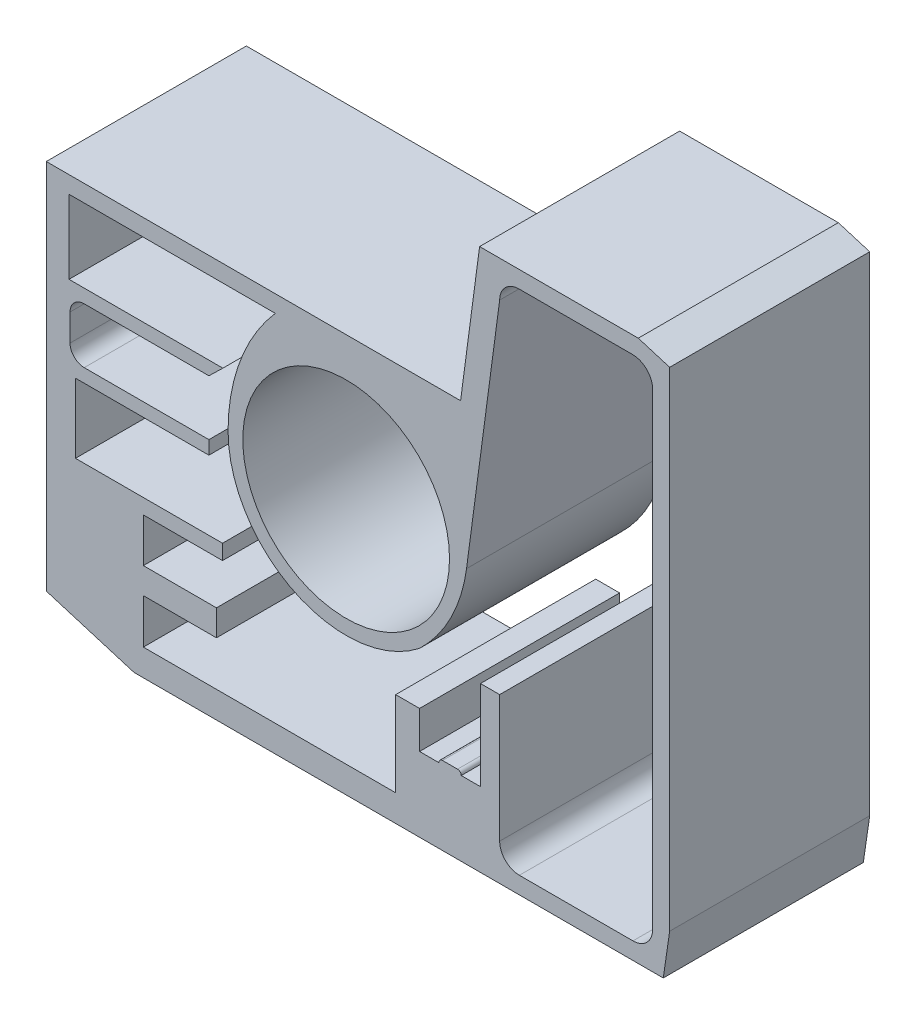
from build123d import *

# Parameters (mm, degrees)
CROQUIS1_R              = 36.48
SALIENTE_EXTRUIR1_DEPTH = 35.3


with BuildPart() as part:
    # Croquis1 → Saliente-Extruir1 (new, symmetric)
    with BuildSketch(Plane.XY):
        Polygon((114.170497813, 97.385634303), (103.092241408, 100.742040907), (47.092241408, 100.742040907), (40.383016369, 50.277319492), (-25, 50.277319492), (-105.829502187, 50.277319492), (-105.829502187, -81.012611613), (-74.846281109, -90.399674345), (111.911647615, -90.399674345), (114.170497813, -74.959018563), align=None)
        Circle(CROQUIS1_R, mode=Mode.SUBTRACT)
        with BuildLine():
            Line((39.311090941, -62.873407285), (33.988381842, -62.873407285))
            ThreePointArc((33.988381842, -62.873407285), (33.069143027, -63.25416847), (32.688381842, -64.173407285))
            Line((32.688381842, -64.173407285), (25.899736392, -64.173407285))
            Line((25.899736392, -64.173407285), (25.899736392, -51.012611613))
            Line((25.899736392, -51.012611613), (17.468766423, -51.012611613))
            Line((17.468766423, -51.012611613), (17.468766423, -64.173407285))
            Line((17.468766423, -64.173407285), (17.468766423, -81.012611613))
            Line((17.468766423, -81.012611613), (-71.573973225, -81.012611613))
            Line((-71.573973225, -81.012611613), (-71.573973225, -65.27493481))
            Line((-71.573973225, -65.27493481), (-45.773973225, -65.27493481))
            Line((-45.773973225, -65.27493481), (-45.773973225, -56.101811779))
            Line((-45.773973225, -56.101811779), (-71.573973225, -56.101811779))
            Line((-71.573973225, -56.101811779), (-71.573973225, -40.601811779))
            Line((-71.573973225, -40.601811779), (-43.629552583, -40.601811779))
            Line((-43.629552583, -40.601811779), (-43.629552583, -35.286923245))
            Line((-43.629552583, -35.286923245), (-95.529552548, -35.288826129))
            Line((-95.529552548, -35.288826129), (-95.530450826, -10.788826145))
            Line((-95.530450826, -10.788826145), (-48.440569068, -10.788826145))
            Line((-48.440569068, -10.788826145), (-48.440569068, -6.028234661))
            Line((-48.440569068, -6.028234661), (-92.440569068, -6.028234661))
            ThreePointArc((-92.440569068, -6.028234661), (-95.977129578, -4.562741665), (-97.440568225, -1.025330565))
            Line((-97.440568225, -1.025330565), (-97.440568225, 8.474669435))
            ThreePointArc((-97.440568225, 8.474669435), (-95.977129578, 12.012080534), (-92.440569068, 13.47757353))
            Line((-92.440569068, 13.47757353), (-48.440569068, 13.47757353))
            Line((-48.440569068, 13.47757353), (-43.508684083, 18.277319492))
            Line((-43.508684083, 18.277319492), (-97.808684083, 18.277319492))
            Line((-97.808684083, 18.277319492), (-97.808684083, 44.277319492))
            Line((-97.808684083, 44.277319492), (-25, 44.277319492))
            ThreePointArc((-25, 44.277319492), (-37.368804618, 23.656765735), (-41.676007876, 0))
            ThreePointArc((-41.676007876, 0), (-18.131354261, -37.525239842), (25.899736392, -32.651084015))
            ThreePointArc((25.899736392, -32.651084015), (36.972896923, -17.738767673), (42.48, 0))
            Line((42.48, 0), (54.170497813, 87.932318843))
            ThreePointArc((54.170497813, 87.932318843), (56.165019227, 92.747519492), (60.980219877, 94.742040907))
            Line((60.980219877, 94.742040907), (101.077345244, 94.742040907))
            ThreePointArc((101.077345244, 94.742040907), (106.092961526, 92.664504619), (108.170497813, 87.648888338))
            Line((108.170497813, 87.648888338), (108.170497813, -77.448237029))
            ThreePointArc((108.170497813, -77.448237029), (106.134468962, -82.363645495), (101.219060497, -84.399674345))
            Line((101.219060497, -84.399674345), (61.121935129, -84.399674345))
            ThreePointArc((61.121935129, -84.399674345), (56.206526664, -82.363645495), (54.170497813, -77.448237029))
            Line((54.170497813, -77.448237029), (54.170497813, -32.651084015))
            Line((54.170497813, -32.651084015), (47.399736392, -32.651084015))
            Line((47.399736392, -32.651084015), (47.399736392, -64.173407285))
            Line((47.399736392, -64.173407285), (40.611090941, -64.173407285))
            ThreePointArc((40.611090941, -64.173407285), (40.230329756, -63.25416847), (39.311090941, -62.873407285))
        make_face(mode=Mode.SUBTRACT)
    extrude(amount=SALIENTE_EXTRUIR1_DEPTH, both=True)


solid = part.part
